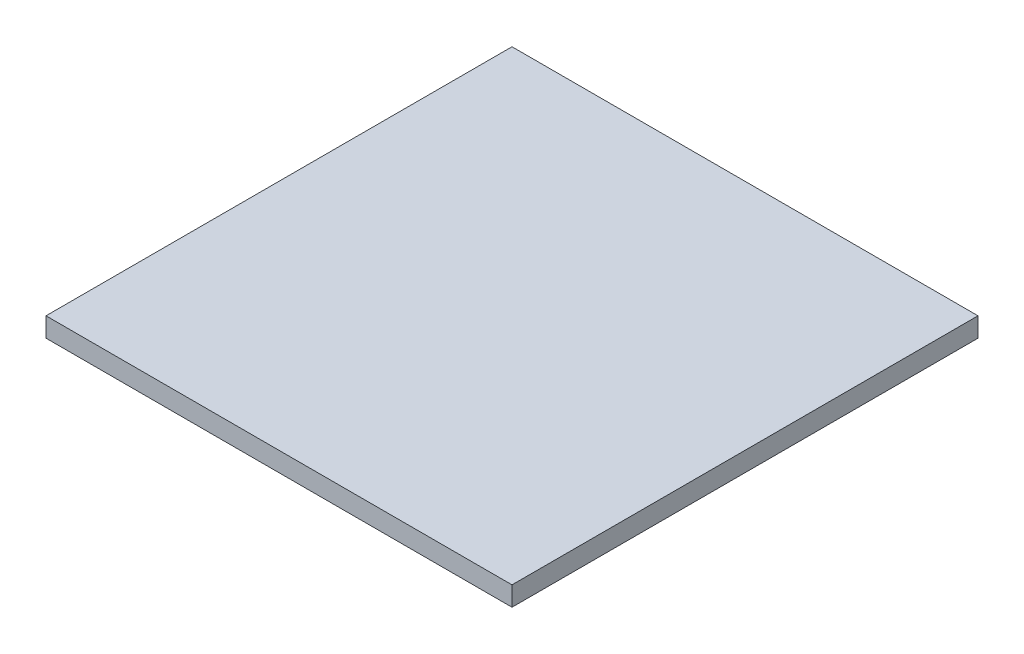
from build123d import *

# Parameters (mm, degrees)
SKETCH1_W           = 76.2
SKETCH1_H           = 76.2
BOSS_EXTRUDE1_DEPTH = 3.175


with BuildPart() as part:
    # Sketch1 → Boss-Extrude1 (new body)
    with BuildSketch(Plane(origin=(0, 0, 0), x_dir=(1, 0, 0), z_dir=(0, 1, 0))):
        with Locations((38.1, 38.1)):
            Rectangle(SKETCH1_W, SKETCH1_H)
    extrude(amount=BOSS_EXTRUDE1_DEPTH)


solid = part.part
